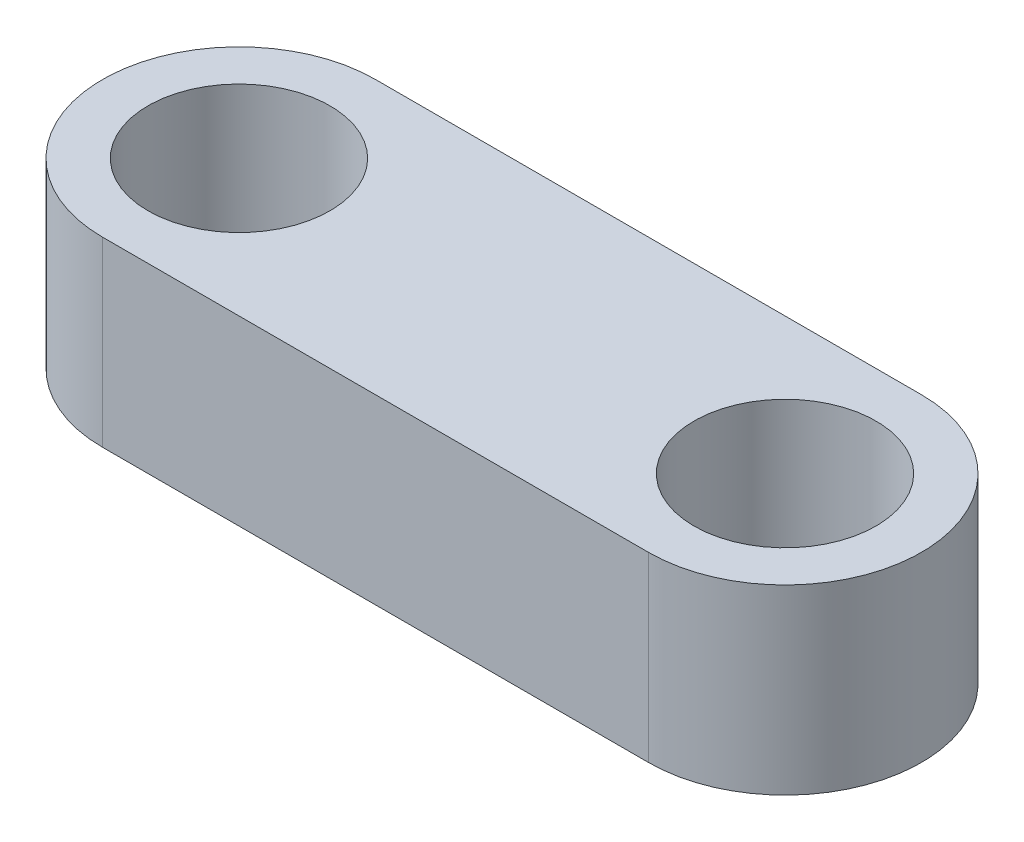
from build123d import *

# Parameters (mm, degrees)
CROQUIS1_R              = 5
SALIENTE_EXTRUIR1_DEPTH = 10
ESCALA1_SCALE           = 0.75


with BuildPart() as part:
    # Croquis1 → Saliente-Extruir1 (new body)
    with BuildSketch(Plane(origin=(0, 0, 0), x_dir=(1, 0, 0), z_dir=(0, 1, 0))):
        with BuildLine():
            Line((0, 7.5), (30, 7.5))
            ThreePointArc((30, 7.5), (37.5, 0), (30, -7.5))
            Line((30, -7.5), (0, -7.5))
            ThreePointArc((0, -7.5), (-7.5, 0), (0, 7.5))
        make_face()
        with Locations(Location((0, 0, 0), (0, 0, 270))):
            Circle(CROQUIS1_R, mode=Mode.SUBTRACT)
        with Locations(Location((30, 0, 0), (0, 0, 270))):
            Circle(CROQUIS1_R, mode=Mode.SUBTRACT)
    extrude(amount=SALIENTE_EXTRUIR1_DEPTH)


with BuildPart() as part_1:
    # Escala1: scaled about (15, 5, 0)
    add(part.part.scale(ESCALA1_SCALE).moved(Location((3.75, 1.25, 0))))


solid = part_1.part
